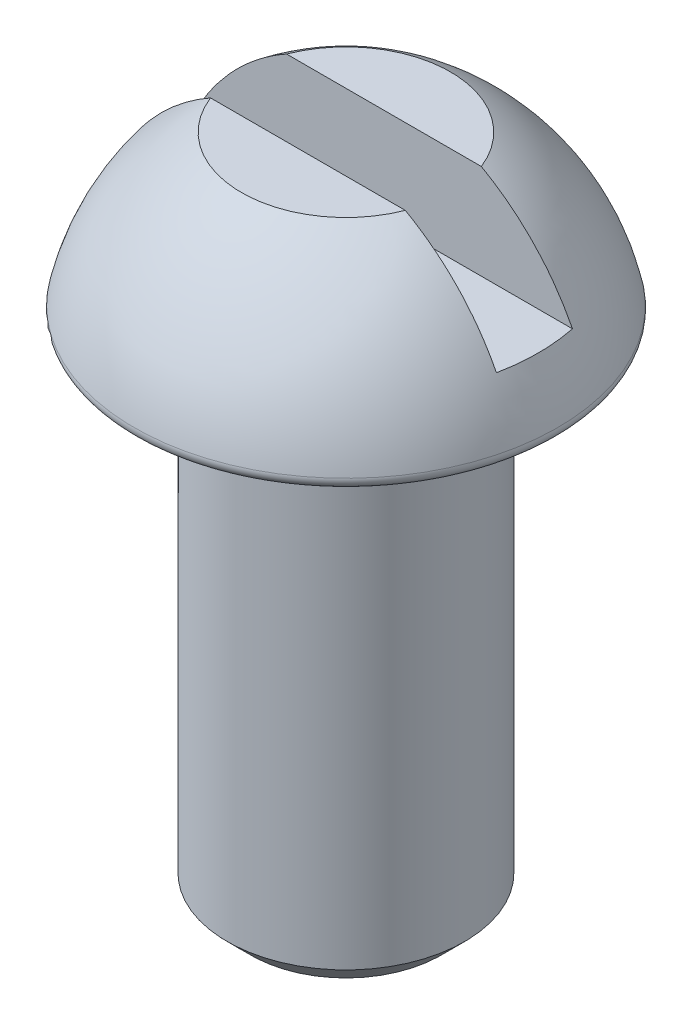
from build123d import *

# Parameters (mm, degrees)
FILLET_1_R          = 0.1
SKETCH_3_W          = 5
SKETCH_3_H          = 0.8
CUT_EXTRUDE_2_DEPTH = 1


with BuildPart() as part:
    # Эскиз1 → Повернуть1 (revolve)
    with BuildSketch(Plane.XY):
        with BuildLine():
            Line((2.25, 5.3), (1.25, 5.3))
            Line((1.25, 5.3), (1.25, 0.25))
            Line((1.25, 0.25), (1, 0))
            Line((1, 0), (0, 0))
            Line((0, 0), (0, 7))
            Line((0, 7), (1.1, 7))
            ThreePointArc((1.1, 7), (1.861991249, 6.27649408), (2.25, 5.3))
        make_face()
    revolve(axis=Axis((0, 0, 0), (0, 1, 0)))

    # Скругление1
    fillet_1_edges = [part.edges().sort_by_distance(p)[0] for p in [
        (-2.25, 5.3, 0),
    ]]
    fillet(fillet_1_edges, radius=FILLET_1_R)

    # Эскиз3 → Вырез-Вытянуть2 (cut)
    with BuildSketch(Plane(origin=(0, 7, 0), x_dir=(-1, 0, 0), z_dir=(0, 1, 0))):
        Rectangle(SKETCH_3_W, SKETCH_3_H)
    extrude(amount=-CUT_EXTRUDE_2_DEPTH, mode=Mode.SUBTRACT)


solid = part.part
